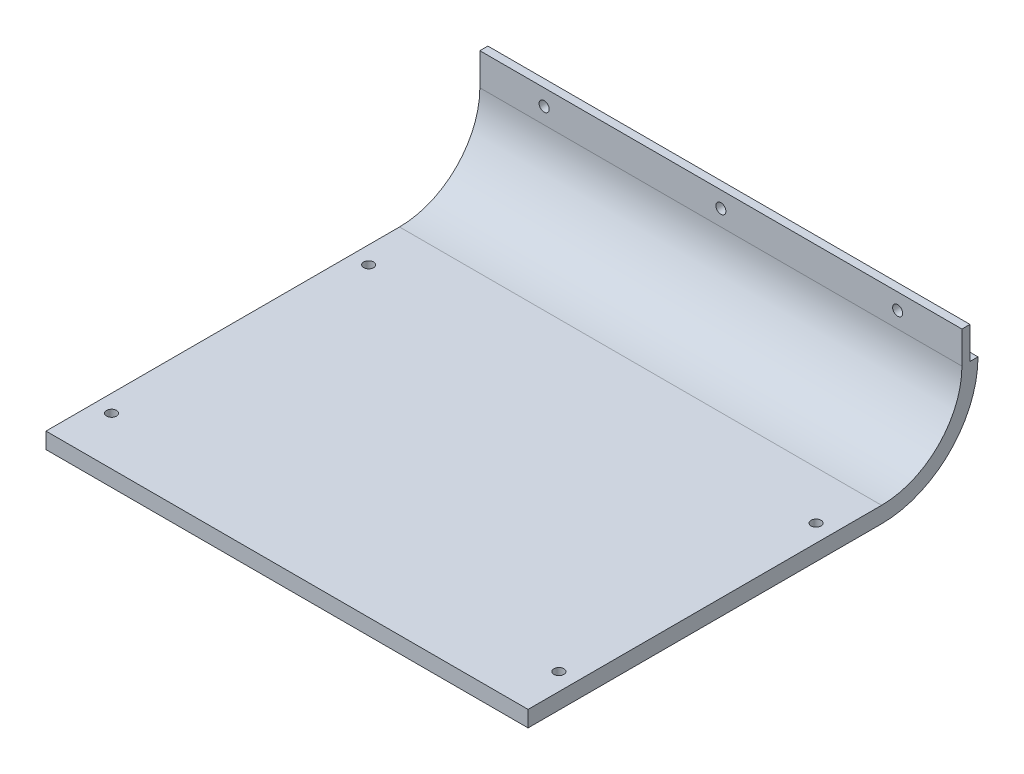
from build123d import *

# Parameters (mm, degrees)
BOSS_EXTRUDE1_DEPTH      = 190.5
BOSS_EXTRUDE1_DEPTH_BACK = 190.5
SKETCH2_W                = 381
SKETCH2_H                = 6.35
BOSS_EXTRUDE2_DEPTH      = 25.4
SKETCH3_R                = 3.96875
CUT_EXTRUDE1_DEPTH       = 25.4
SKETCH4_R                = 3.937
CUT_EXTRUDE2_DEPTH       = 302.34078715


with BuildPart() as part:
    # Sketch1 → Boss-Extrude1 (new, two sides: drawn at the far end of the back side and taken through both)
    with BuildSketch(Plane(origin=(0, 0, 0), x_dir=(0, 0, -1), z_dir=(1, 0, 0)).offset(-BOSS_EXTRUDE1_DEPTH_BACK)):
        with BuildLine():
            Line((-139.7, 0), (139.7, 0))
            ThreePointArc((139.7, 0), (193.581536726, 22.318463274), (215.9, 76.2))
            Line((215.9, 76.2), (203.2, 76.2))
            ThreePointArc((203.2, 76.2), (184.601280605, 31.298719395), (139.7, 12.7))
            Line((139.7, 12.7), (-139.7, 12.7))
            Line((-139.7, 12.7), (-139.7, 0))
        make_face()
    extrude(amount=BOSS_EXTRUDE1_DEPTH + BOSS_EXTRUDE1_DEPTH_BACK)

    # Sketch2 → Boss-Extrude2 (add)
    with BuildSketch(Plane(origin=(0, 76.2, 0), x_dir=(1, 0, 0), z_dir=(0, 1, 0))):
        with Locations((0, 206.375)):
            Rectangle(SKETCH2_W, SKETCH2_H)
    extrude(amount=BOSS_EXTRUDE2_DEPTH)

    # Sketch3 → Cut-Extrude1 (cut)
    with BuildSketch(Plane(origin=(0, 0, -209.55), x_dir=(-1, 0, 0), z_dir=(0, 0, -1))):
        with Locations((-139.7, 88.9)):
            Circle(SKETCH3_R)
        with Locations((139.7, 88.9)):
            Circle(SKETCH3_R)
        with Locations((0, 88.9)):
            Circle(SKETCH3_R)
    extrude(amount=-CUT_EXTRUDE1_DEPTH, mode=Mode.SUBTRACT)

    # Sketch4 → Cut-Extrude2 (cut, through all)
    with BuildSketch(Plane(origin=(0, 12.7, 0), x_dir=(1, 0, 0), z_dir=(0, 1, 0))):
        with Locations((176.784, -101.6)):
            Circle(SKETCH4_R)
        with Locations((176.784, 101.6)):
            Circle(SKETCH4_R)
        with Locations((-176.784, -101.6)):
            Circle(SKETCH4_R)
        with Locations((-176.784, 101.6)):
            Circle(SKETCH4_R)
    extrude(amount=-CUT_EXTRUDE2_DEPTH, mode=Mode.SUBTRACT)


solid = part.part
